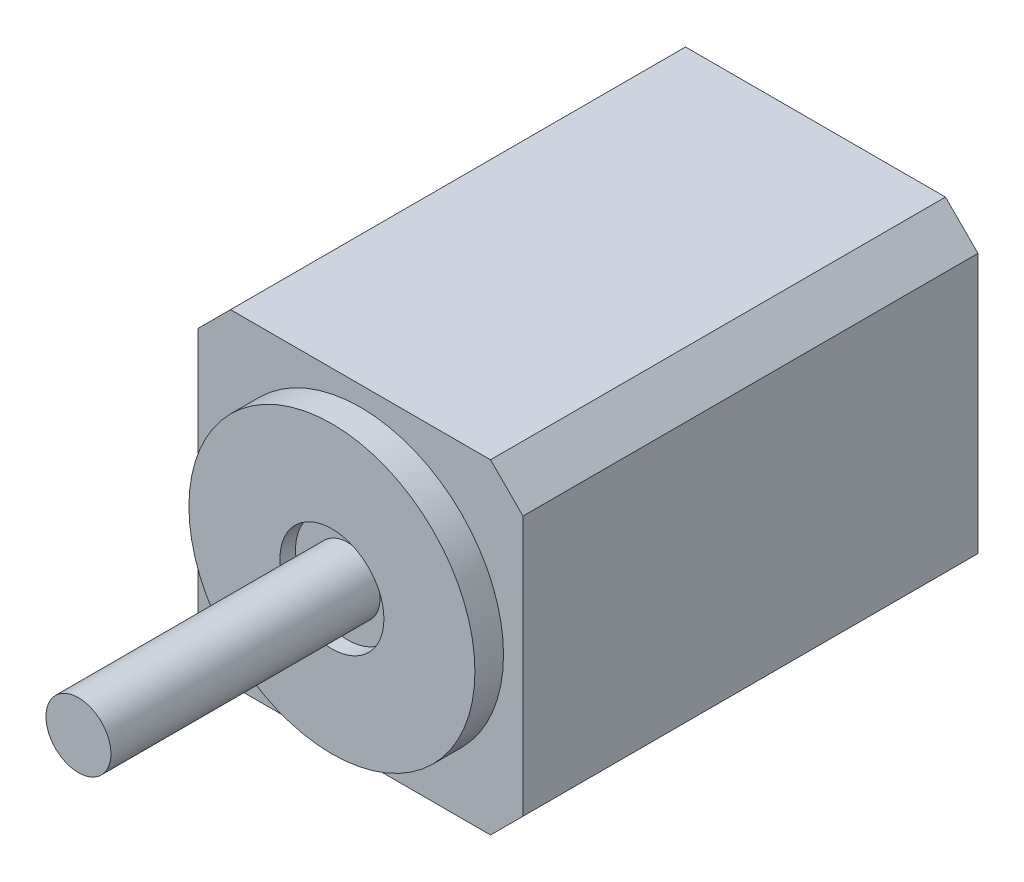
from build123d import *

# Parameters (mm, degrees)
SKETCH1_W           = 25
SKETCH1_H           = 25
BOSS_EXTRUDE1_DEPTH = 35
SKETCH2_R           = 11
BOSS_EXTRUDE2_DEPTH = 2.2
CHAMFER1_SIZE       = 2.5
SKETCH4_R           = 4
CUT_EXTRUDE1_DEPTH  = 1.2
SKETCH3_R           = 2.5
BOSS_EXTRUDE3_DEPTH = 20.7


with BuildPart() as part:
    # Sketch1 → Boss-Extrude1 (new body)
    with BuildSketch(Plane.XY):
        Rectangle(SKETCH1_W, SKETCH1_H)
    extrude(amount=BOSS_EXTRUDE1_DEPTH)

    # Sketch2 → Boss-Extrude2 (add)
    with BuildSketch(Plane.XY.offset(35)):
        Circle(SKETCH2_R)
    extrude(amount=BOSS_EXTRUDE2_DEPTH)

    # Chamfer1
    chamfer1_edges = [part.edges().sort_by_distance(p)[0] for p in [
        (12.5, -12.5, 17.5),
        (-12.5, -12.5, 17.5),
        (-12.5, 12.5, 17.5),
        (12.5, 12.5, 17.5),
    ]]
    chamfer(chamfer1_edges, length=CHAMFER1_SIZE)

    # Sketch4 → Cut-Extrude1 (cut)
    with BuildSketch(Plane.XY.offset(37.2)):
        Circle(SKETCH4_R)
    extrude(amount=-CUT_EXTRUDE1_DEPTH, mode=Mode.SUBTRACT)

    # Sketch3 → Boss-Extrude3 (add)
    with BuildSketch(Plane.XY.offset(36)):
        Circle(SKETCH3_R)
    extrude(amount=BOSS_EXTRUDE3_DEPTH)


solid = part.part
